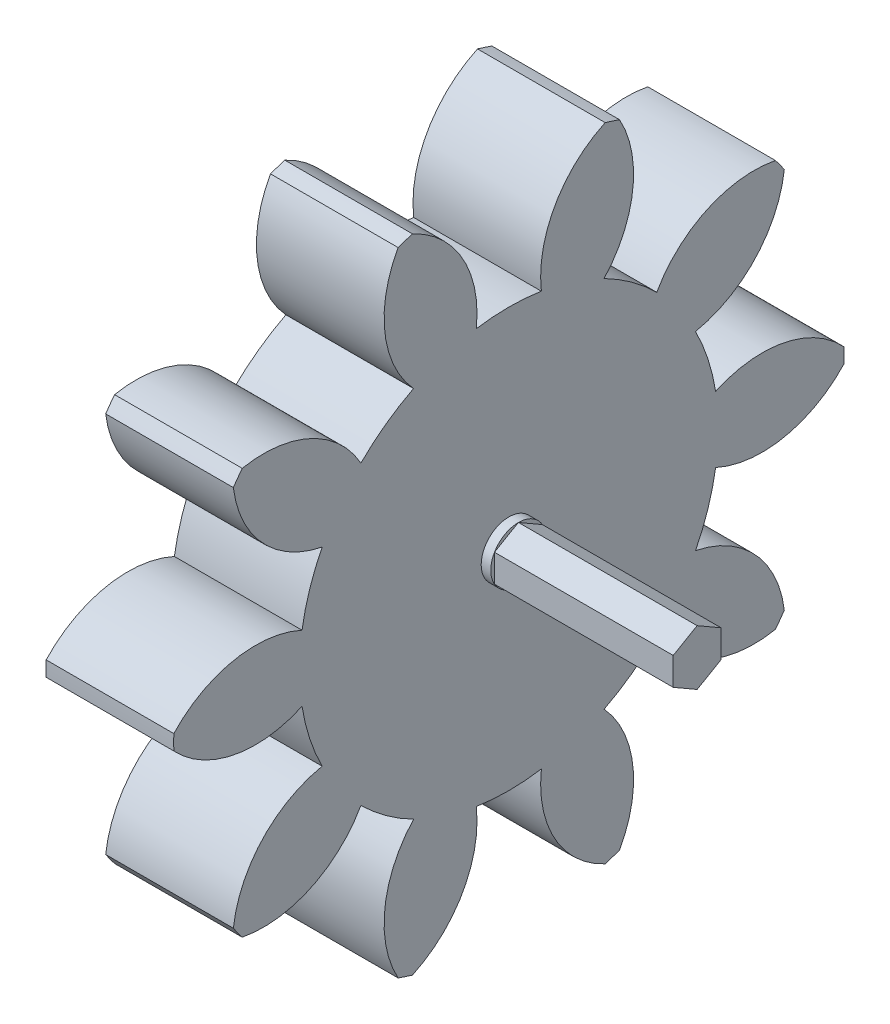
from build123d import *

# Parameters (mm, degrees)
BASPROSKE_W         = 4
BASPROSKE_H         = 10.5
TOOTHCUT_DEPTH      = 16.378556499
TEETHCUTS_COUNT     = 10
TEETHCUTS_ANGLE     = 324
BORSKE_R            = 0.5
BORE_DEPTH          = 50.0000508
SKETCH2_R           = 0.866025404
BOSS_EXTRUDE1_DEPTH = 4.3
BOSS_EXTRUDE2_DEPTH = 9.9


with BuildPart() as part:
    # BasProSke → Base-Revolve (revolve)
    with BuildSketch(Plane(origin=(0, 0, 0), x_dir=(1, 0, 0), z_dir=(0, 1, 0))):
        with Locations((2, 5.25)):
            Rectangle(BASPROSKE_W, BASPROSKE_H)
    revolve(axis=Axis((-10, 0, 0), (1, 0, 0)))

    # TooCutSke → ToothCut (cut, through all)
    with BuildSketch(Plane(origin=(0, 0, 0), x_dir=(0, 0, -1), z_dir=(1, 0, 0))):
        with BuildLine():
            ThreePointArc((1.019600066, 6.481797432), (0, 6.5615), (-1.019600066, 6.481797432))
            ThreePointArc((-1.019600066, 6.481797432), (-1.451036104, 8.608938557), (-3.053606956, 10.072712133))
            ThreePointArc((-3.053606956, 10.072712133), (0, 10.5254), (3.053606956, 10.072712133))
            ThreePointArc((3.053606956, 10.072712133), (1.451036104, 8.608938557), (1.019600066, 6.481797432))
        make_face()
    toothcut = extrude(amount=TOOTHCUT_DEPTH, mode=Mode.SUBTRACT)

    # TeethCuts: ToothCut ×10 about axis
    teethcuts_axis = Axis((-10, 0, 0), (1, 0, 0))
    for i in range(1, TEETHCUTS_COUNT):
        add(toothcut.rotate(teethcuts_axis, i * TEETHCUTS_ANGLE / (TEETHCUTS_COUNT - 1)), mode=Mode.SUBTRACT)

    # BorSke → Bore (cut, symmetric)
    with BuildSketch(Plane(origin=(0, 0, 0), x_dir=(0, 0, -1), z_dir=(1, 0, 0))):
        Circle(BORSKE_R)
    extrude(amount=BORE_DEPTH, both=True, mode=Mode.SUBTRACT)

    # Sketch2 → Boss-Extrude1 (add)
    with BuildSketch(Plane.ZY):
        Circle(SKETCH2_R)
    extrude(amount=-BOSS_EXTRUDE1_DEPTH)

    # Sketch2<3> → Boss-Extrude2 (add)
    with BuildSketch(Plane.ZY):
        Polygon((0.75, -0.433012702), (0.75, 0.433012702), (0, 0.866025404), (-0.75, 0.433012702), (-0.75, -0.433012702), (0, -0.866025404), align=None)
    extrude(amount=-BOSS_EXTRUDE2_DEPTH)


solid = part.part
